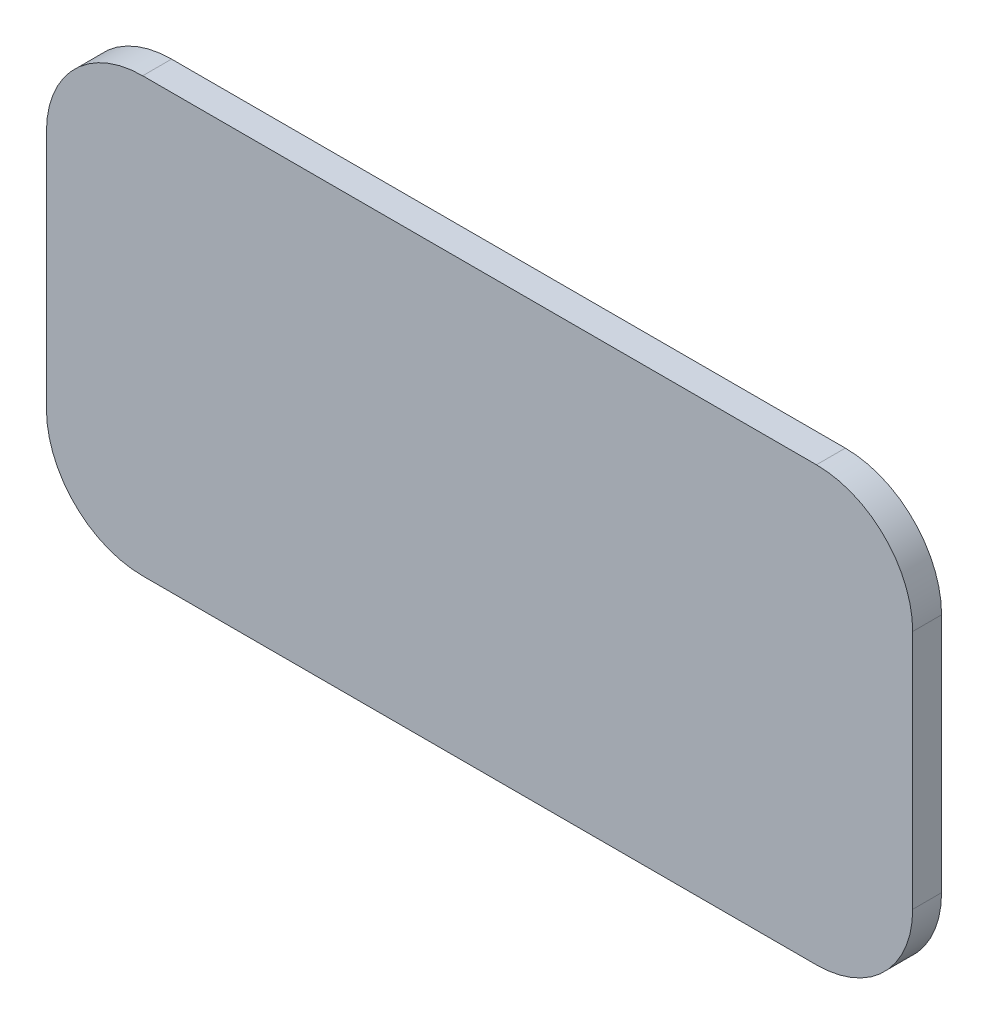
from build123d import *

# Parameters (mm, degrees)
SKETCH1_W           = 90
SKETCH1_H           = 45
BOSS_EXTRUDE1_DEPTH = 3
FILLET1_R           = 10


with BuildPart() as part:
    # Sketch1 → Boss-Extrude1 (new body)
    with BuildSketch(Plane.XY):
        Rectangle(SKETCH1_W, SKETCH1_H)
    extrude(amount=BOSS_EXTRUDE1_DEPTH)

    # Fillet1
    fillet1_edges = [part.edges().sort_by_distance(p)[0] for p in [
        (45, -22.5, 1.5),
        (-45, -22.5, 1.5),
        (-45, 22.5, 1.5),
        (45, 22.5, 1.5),
    ]]
    fillet(fillet1_edges, radius=FILLET1_R)


solid = part.part
